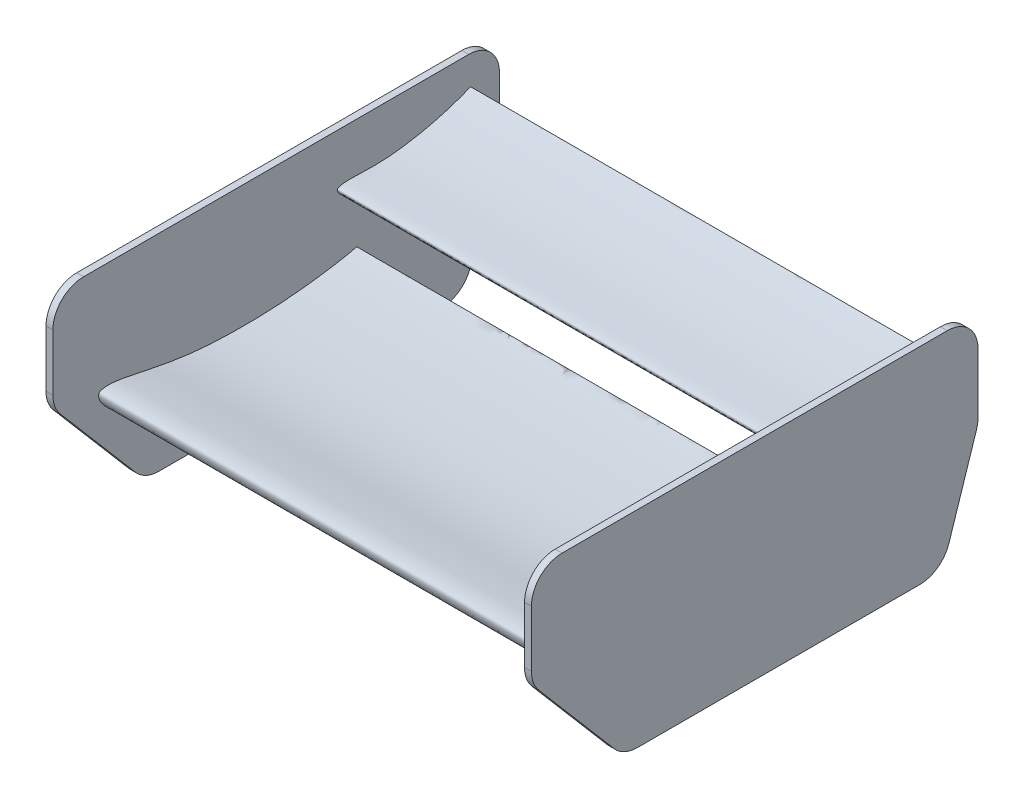
from build123d import *

# Parameters (mm, degrees)
EXTRUDED_AIRFOILS_DEPTH   = 487.449999952
EXTRUDED_AIRFOILS_2_DEPTH = 487.449999952
EXTRUDED_ENDPLATE_DEPTH   = 14.200000048


with BuildPart() as part:
    # Airfoils Sketch → Extruded Airfoils (new body)
    with BuildSketch(Plane(origin=(0, 0, 0), x_dir=(0, 0, -1), z_dir=(1, 0, 0))):
        with BuildLine():
            add(Edge.make_bspline(
                [(897.989632302, 946.000000046), (898.000513914, 945.951839281), (894.184279323, 944.352851316), (890.699819702, 942.296180156), (882.791939538, 937.933635623), (873.645939793, 932.954112993), (861.849234489, 927.640797519), (847.825954561, 922.30857822), (831.530849272, 916.634932924), (813.2008765, 910.647350929), (793.094311676, 904.422943815), (771.513904823, 898.06413618), (748.758616882, 891.715468852), (725.138031005, 885.514054628), (700.954405569, 879.629236447), (676.498467134, 874.257660211), (652.057841056, 869.565934163), (627.831804234, 865.795405193), (603.922786486, 863.282964935), (580.420628735, 862.073173574), (557.409835441, 862.139402028), (535.014387038, 863.428748658), (513.364868859, 865.878949834), (492.614715532, 869.402461043), (472.917623861, 873.841507376), (454.449730598, 879.083530955), (437.385501316, 885.029883679), (421.874189905, 891.561628897), (408.048549489, 898.559233256), (396.013645082, 905.891109977), (385.858554918, 913.416953036), (377.637446771, 920.978739297), (371.3813299, 928.395891647), (367.105151877, 935.48676691), (364.93961271, 941.592944474), (364.478646936, 945.808092476), (364.72423345, 948.022458751), (364.958745374, 949.103505513), (365.207345688, 949.805698607), (365.433998761, 950.327271857), (365.635213878, 950.682005569), (365.862098213, 951.012091726), (366.146275406, 951.304038649), (366.468830129, 951.577773117), (366.958374644, 951.951982083), (367.677617136, 952.372493507), (368.829149529, 952.929808373), (370.247862327, 953.455636597), (373.990203501, 954.551133318), (380.956406634, 955.316418787), (391.975654885, 955.164476466), (405.835940211, 953.699088451), (422.612261866, 950.928158747), (442.470944413, 946.830199159), (465.539283336, 941.749563758), (491.828789906, 936.399518652), (521.027342465, 931.264471412), (552.59555029, 926.799070536), (585.816105194, 923.592309215), (619.824369214, 921.766444825), (653.851796059, 920.998850705), (687.331665883, 921.160230805), (719.756890506, 922.202805035), (750.588370802, 924.122270917), (779.304150897, 926.732212739), (805.469395405, 929.729342209), (828.782042195, 932.897265457), (848.904387076, 936.025543084), (865.887900109, 938.991006858), (878.885329483, 941.41974614), (889.414050412, 943.814205441), (893.791195704, 944.72287816), (897.978579692, 946.048917629), (897.989632302, 946.000000046)],
                knots=[0, 0, 0, 0, 0.001812691, 0.006911328, 0.014576348, 0.024172143, 0.035572242, 0.04901308, 0.064512615, 0.081849281, 0.100772139, 0.120997345, 0.142228397, 0.164173399, 0.186536734, 0.209022727, 0.231367049, 0.253319655, 0.274803883, 0.295858285, 0.316448578, 0.336530716, 0.35603337, 0.374893008, 0.392989986, 0.410197087, 0.426388181, 0.441458696, 0.455334222, 0.467938119, 0.479235883, 0.48920359, 0.497850586, 0.505193934, 0.511308341, 0.515097163, 0.516441428, 0.517272652, 0.518060388, 0.518436362, 0.518797413, 0.519153544, 0.519507976, 0.519886846, 0.520288641, 0.521160208, 0.522116283, 0.523720315, 0.52521352, 0.532574604, 0.542380648, 0.554776211, 0.56993128, 0.588004893, 0.609187965, 0.63332852, 0.660001247, 0.688743434, 0.718873444, 0.749542513, 0.780126844, 0.81020899, 0.839387288, 0.867183376, 0.893104481, 0.916760447, 0.937874173, 0.956198632, 0.971543675, 0.983762849, 0.992691516, 0.998158824, 1, 1, 1, 1], degree=3))
        make_face()
    extrude(amount=EXTRUDED_AIRFOILS_DEPTH)



with BuildPart() as body_2:
    # Airfoils Sketch → Extruded Airfoils 2 (new body)
    with BuildSketch(Plane(origin=(0, 0, 0), x_dir=(0, 0, -1), z_dir=(1, 0, 0))):
        with BuildLine():
            add(Edge.make_bspline(
                [(1133.247895197, 1114.879542376), (1133.257889129, 1114.855688341), (1131.434719761, 1113.683728474), (1129.824327277, 1112.305849739), (1126.141844817, 1109.336134346), (1121.876795736, 1105.93553218), (1116.274737058, 1102.121638029), (1109.525815584, 1098.095466266), (1101.636024801, 1093.686527345), (1092.725099441, 1088.930555015), (1082.919257361, 1083.890819778), (1072.365356272, 1078.647695245), (1061.204468452, 1073.302936103), (1049.583821306, 1067.95543146), (1037.643932135, 1062.720030145), (1025.516886093, 1057.724616348), (1013.335900755, 1053.081297204), (1001.181820878, 1048.932697852), (989.076841873, 1045.461921277), (977.063255201, 1042.700125727), (965.187074774, 1040.641260951), (953.517067962, 1039.269314632), (942.126260842, 1038.564045827), (931.101765847, 1038.494250746), (920.537218711, 1038.992520978), (910.533717978, 1040.0168145), (901.190234896, 1041.532112662), (892.594580644, 1043.490637714), (884.826108725, 1045.842803209), (877.95098605, 1048.530286448), (872.027925809, 1051.488812762), (867.0992441, 1054.641792675), (863.197362135, 1057.898895737), (860.346512648, 1061.167780621), (858.674006456, 1064.120688232), (858.052812656, 1066.253150624), (857.978083283, 1067.417773385), (858.000726187, 1067.996764043), (858.065096597, 1068.381603859), (858.134574409, 1068.671274336), (858.206105494, 1068.872566556), (858.293119995, 1069.063479129), (858.413158203, 1069.239928791), (858.554650104, 1069.410474292), (858.773144952, 1069.648038885), (859.105918282, 1069.930381677), (859.649245639, 1070.322615226), (860.333262437, 1070.722908685), (862.164110605, 1071.628420508), (865.688028924, 1072.656830173), (871.386147104, 1073.580745527), (878.669288174, 1074.08553438), (887.575421688, 1074.182095852), (898.192300986, 1073.874473865), (910.554269705, 1073.351882661), (924.602388288, 1072.983308807), (940.131587233, 1072.990244627), (956.822266754, 1073.5581591), (974.250828238, 1074.925640028), (991.960126384, 1077.077107853), (1009.583050956, 1079.776229197), (1026.839019154, 1082.904758451), (1043.470794694, 1086.391924159), (1059.200673736, 1090.186471195), (1073.776360571, 1094.144760342), (1087.001131304, 1098.070787819), (1098.738849553, 1101.825451347), (1108.834451311, 1105.269478317), (1117.325690701, 1108.344013833), (1123.809521832, 1110.779110652), (1129.02298362, 1112.971973897), (1131.198289803, 1113.83885312), (1133.237744216, 1114.903771264), (1133.247895197, 1114.879542376)],
                knots=[0, 0, 0, 0, 0.001812691, 0.006911328, 0.014576348, 0.024172143, 0.035572242, 0.04901308, 0.064512615, 0.081849281, 0.100772139, 0.120997345, 0.142228397, 0.164173399, 0.186536734, 0.209022727, 0.231367049, 0.253319655, 0.274803883, 0.295858285, 0.316448578, 0.336530716, 0.35603337, 0.374893008, 0.392989986, 0.410197087, 0.426388181, 0.441458696, 0.455334222, 0.467938119, 0.479235883, 0.48920359, 0.497850586, 0.505193934, 0.511308341, 0.515097163, 0.516441428, 0.517272652, 0.518060388, 0.518436362, 0.518797413, 0.519153544, 0.519507976, 0.519886846, 0.520288641, 0.521160208, 0.522116283, 0.523720315, 0.52521352, 0.532574604, 0.542380648, 0.554776211, 0.56993128, 0.588004893, 0.609187965, 0.63332852, 0.660001247, 0.688743434, 0.718873444, 0.749542513, 0.780126844, 0.81020899, 0.839387288, 0.867183376, 0.893104481, 0.916760447, 0.937874173, 0.956198632, 0.971543675, 0.983762849, 0.992691516, 0.998158824, 1, 1, 1, 1], degree=3))
        make_face()
    extrude(amount=EXTRUDED_AIRFOILS_2_DEPTH)


with BuildPart() as part_1:
    add(part.part)

    add(body_2.part)  # Extruded Endplate merges body 2
    # Endplate Sketch → Extruded Endplate (add)
    with BuildSketch(Plane(origin=(501.65, 0, 0), x_dir=(0, 0, -1), z_dir=(1, 0, 0))):
        with BuildLine():
            Line((333.44768579, 1174.600000046), (1129.475, 1174.600000046))
            ThreePointArc((1129.475, 1174.600000046), (1174.376280605, 1156.001280651), (1192.975, 1111.100000046))
            Line((1192.975, 1111.100000046), (1192.975, 986.671665425))
            ThreePointArc((1192.975, 986.671665425), (1192.187961727, 976.704999408), (1189.846356489, 966.985393159))
            Line((1189.846356489, 966.985393159), (1132.89690026, 792.340042461))
            ThreePointArc((1132.89690026, 792.340042461), (1109.822807151, 760.634057096), (1072.525543772, 748.526314727))
            Line((1072.525543772, 748.526314727), (489.177152122, 748.526314727))
            ThreePointArc((489.177152122, 748.526314727), (462.584654451, 754.362729445), (440.880498348, 770.799099999))
            Line((440.880498348, 770.799099999), (285.151032016, 953.232285636))
            ThreePointArc((285.151032016, 953.232285636), (273.869638177, 972.488923615), (269.94768579, 994.459500364))
            Line((269.94768579, 994.459500364), (269.94768579, 1111.100000046))
            ThreePointArc((269.94768579, 1111.100000046), (288.546405185, 1156.001280651), (333.44768579, 1174.600000046))
        make_face()
    extrude(amount=-EXTRUDED_ENDPLATE_DEPTH)

    # Mirror 2: part across plane


with BuildPart() as part_2:
    add(part_1.part)
    add(part_1.part.mirror(Plane(origin=(0, 0, 0), x_dir=(0, 0, 1), z_dir=(1, 0, 0))))


solid = part_2.part
